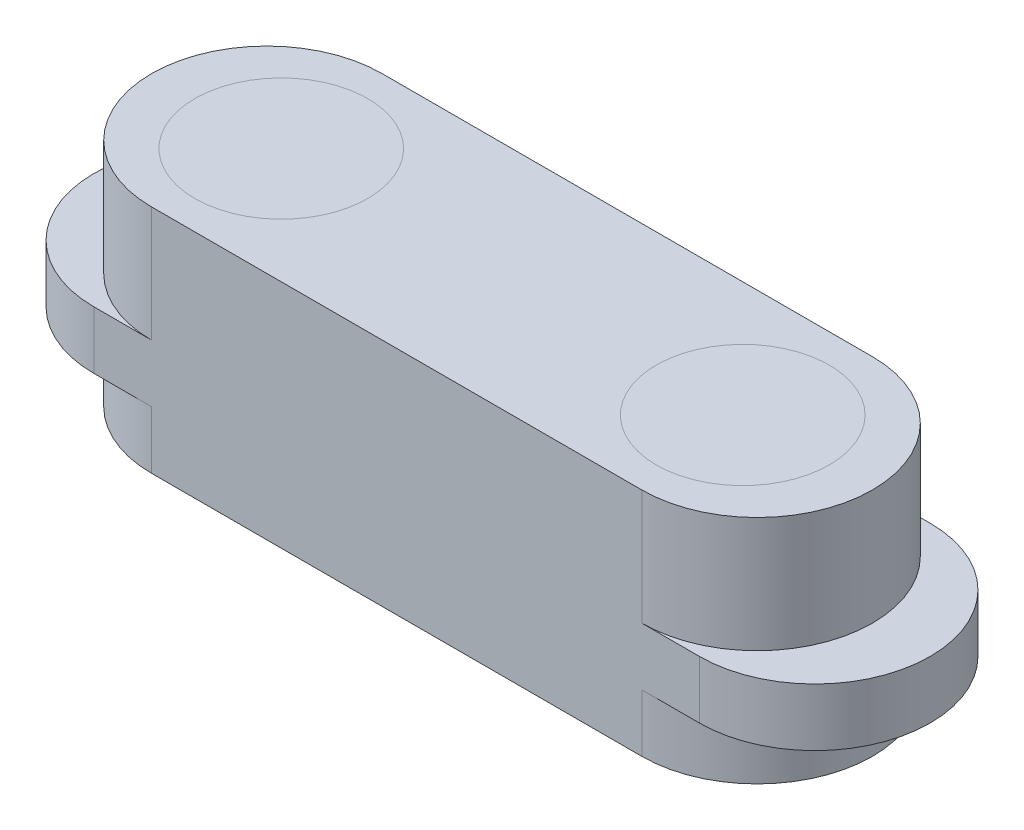
from build123d import *

# Parameters (mm, degrees)
BOSS_EXTRUDE2_DEPTH         = 1
BOSS_EXTRUDE3_DEPTH         = 2
SKETCH7_R                   = 1.5
SKETCH7_R_2                 = 0.45
CUT_EXTRUDE1_DEPTH          = 1
SKETCH8_R                   = 1.5
BOSS_EXTRUDE4_DEPTH         = 1
BOSS_EXTRUDE4_2_DEPTH       = 1
BOSS_EXTRUDE12_DEPTH        = 1
BOSS_EXTRUDE12_DEPTH_BACK   = 4.5
SKETCH9_R                   = 0.45
BOSS_EXTRUDE12_2_DEPTH      = 1
BOSS_EXTRUDE12_2_DEPTH_BACK = 4.5
BOSS_EXTRUDE13_START        = 1
BOSS_EXTRUDE13_DEPTH        = 1


with BuildPart() as part:
    # Sketch4 → Boss-Extrude2 (new body)
    with BuildSketch(Plane(origin=(0, 0, 0), x_dir=(1, 0, 0), z_dir=(0, 1, 0))):
        with BuildLine():
            Line((0, 2), (10.5, 2))
            ThreePointArc((10.5, 2), (12.5, 0), (10.5, -2))
            Line((10.5, -2), (0, -2))
            ThreePointArc((0, -2), (-2, 0), (0, 2))
        make_face()
    extrude(amount=BOSS_EXTRUDE2_DEPTH)

    # Sketch5 → Boss-Extrude3 (add)
    with BuildSketch(Plane(origin=(0, 1, 0), x_dir=(1, 0, 0), z_dir=(0, 1, 0))):
        with BuildLine():
            Line((1, 2), (9.5, 2))
            ThreePointArc((9.5, 2), (11.5, 0), (9.5, -2))
            Line((9.5, -2), (1, -2))
            ThreePointArc((1, -2), (-1, 0), (1, 2))
        make_face()
    extrude(amount=BOSS_EXTRUDE3_DEPTH)

    # Sketch7 → Cut-Extrude1 (cut)
    with BuildSketch(Plane(origin=(0, 3, 0), x_dir=(1, 0, 0), z_dir=(0, 1, 0))):
        with Locations(Location((1.25, 0, 0), (0, 0, 270))):
            Circle(SKETCH7_R)
        with Locations(Location((9.25, 0, 0), (0, 0, 270))):
            Circle(SKETCH7_R)
        with Locations(Location((4, 0, 0), (0, 0, 270))):
            Circle(SKETCH7_R_2)
        with Locations(Location((6.5, 0, 0), (0, 0, 270))):
            Circle(SKETCH7_R_2)
    extrude(amount=-CUT_EXTRUDE1_DEPTH, mode=Mode.SUBTRACT)



with BuildPart() as body_2:
    # Sketch8 → Boss-Extrude4 (new body)
    with BuildSketch(Plane(origin=(0, 2, 0), x_dir=(1, 0, 0), z_dir=(0, 1, 0))):
        with Locations(Location((1.25, 0, 0), (0, 0, 270))):
            Circle(SKETCH8_R)
    extrude(amount=BOSS_EXTRUDE4_DEPTH)


with BuildPart() as body_3:
    # Sketch8 → Boss-Extrude4 2 (new body)
    with BuildSketch(Plane(origin=(0, 2, 0), x_dir=(1, 0, 0), z_dir=(0, 1, 0))):
        with Locations(Location((9.25, 0, 0), (0, 0, 270))):
            Circle(SKETCH8_R)
    extrude(amount=BOSS_EXTRUDE4_2_DEPTH)


with BuildPart() as body_4:
    # Sketch9 → Boss-Extrude12 (new, two sides: drawn at the far end of the back side and taken through both)
    with BuildSketch(Plane(origin=(0, 2, 0), x_dir=(1, 0, 0), z_dir=(0, 1, 0)).offset(-BOSS_EXTRUDE12_DEPTH_BACK)):
        with Locations(Location((4, 0, 0), (0, 0, 270))):
            Circle(SKETCH9_R)
    extrude(amount=BOSS_EXTRUDE12_DEPTH + BOSS_EXTRUDE12_DEPTH_BACK)


with BuildPart() as body_5:
    # Sketch9 → Boss-Extrude12 2 (new, two sides: drawn at the far end of the back side and taken through both)
    with BuildSketch(Plane(origin=(0, 2, 0), x_dir=(1, 0, 0), z_dir=(0, 1, 0)).offset(-BOSS_EXTRUDE12_2_DEPTH_BACK)):
        with Locations(Location((6.5, 0, 0), (0, 0, 270))):
            Circle(SKETCH9_R)
    extrude(amount=BOSS_EXTRUDE12_2_DEPTH + BOSS_EXTRUDE12_2_DEPTH_BACK)


with BuildPart() as part_1:
    add(part.part)

    add(body_4.part)  # Boss-Extrude13 merges body 4

    add(body_5.part)  # Boss-Extrude13 merges body 5
    # Sketch11 → Boss-Extrude13 (add)
    with BuildSketch(Plane.XZ.offset(BOSS_EXTRUDE13_START)):
        with BuildLine():
            Line((1, 2), (9.5, 2))
            ThreePointArc((9.5, 2), (11.5, 0), (9.5, -2))
            Line((9.5, -2), (1, -2))
            ThreePointArc((1, -2), (-1, 0), (1, 2))
        make_face()
    extrude(amount=-BOSS_EXTRUDE13_DEPTH)


solid = Compound([body_2.part, body_3.part, part_1.part])
